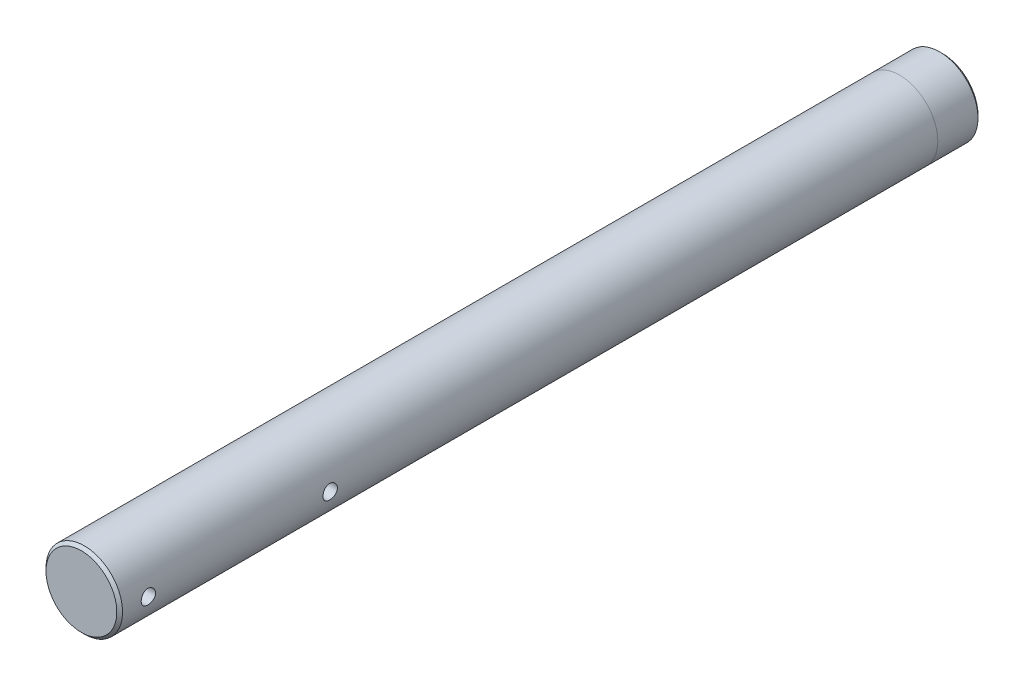
from build123d import *

# Parameters (mm, degrees)
SKETCH1_W               = 90
SKETCH1_H               = 4
CHAMFER1_SIZE           = 0.3
CUT_EXTRUDE1_DEPTH      = 46.354161882
CUT_EXTRUDE1_DEPTH_BACK = 46.354161882
SKETCH6_R               = 0.75


with BuildPart() as part:
    # Sketch1 → Revolve1 (revolve)
    with BuildSketch(Plane(origin=(0, 0, 0), x_dir=(0, 0, -1), z_dir=(1, 0, 0)), mode=Mode.PRIVATE) as revolve1_sk:
        with Locations((0, 2)):
            Rectangle(SKETCH1_W, SKETCH1_H)
    revolve(revolve1_sk.sketch.rotate(Axis((0, 0, 0), (0, 0, -1)), 90), axis=Axis((0, 0, 0), (0, 0, -1)))

    # Chamfer1
    chamfer1_edges = [part.edges().sort_by_distance(p)[0] for p in [
        (-4, 0, 45),
        (-4, 0, -45),
    ]]
    chamfer(chamfer1_edges, length=CHAMFER1_SIZE)

    # Sketch6 → Cut-Extrude1 (cut, two sides: drawn at the far end of the back side and taken through both)
    with BuildSketch(Plane(origin=(0, 0, 0), x_dir=(0, 0, -1), z_dir=(1, 0, 0)).offset(-CUT_EXTRUDE1_DEPTH_BACK)):
        with Locations((-23, 0)):
            Circle(SKETCH6_R)
        with Locations((-42, 0)):
            Circle(SKETCH6_R)
    extrude(amount=CUT_EXTRUDE1_DEPTH + CUT_EXTRUDE1_DEPTH_BACK, mode=Mode.SUBTRACT)


solid = part.part
